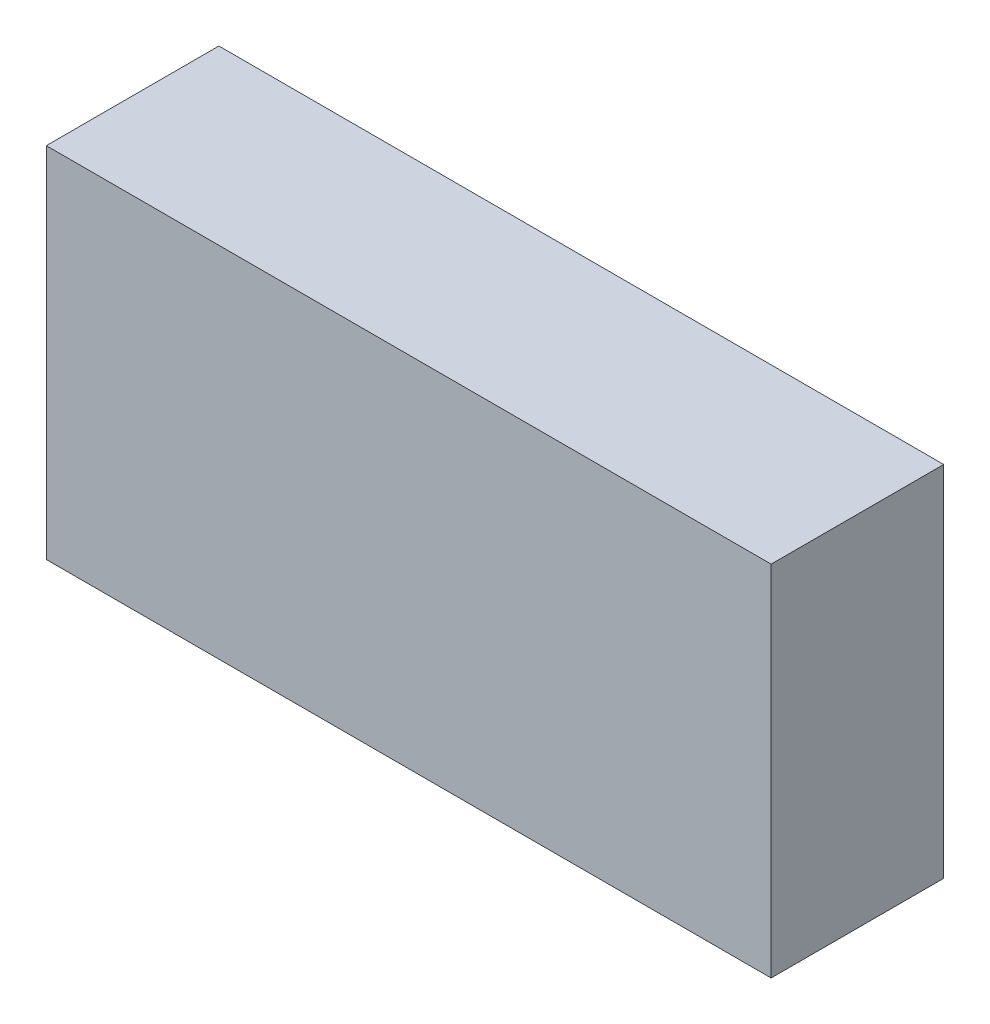
from build123d import *

# Parameters (mm, degrees)
SKETCH_1_W              = 2.73
SKETCH_1_H              = 1.35
COMPONENT_OUTLINE_DEPTH = 0.65


with BuildPart() as part:
    # 草图1 → Component_Outline (new body)
    with BuildSketch(Plane.XY):
        Rectangle(SKETCH_1_W, SKETCH_1_H)
    extrude(amount=COMPONENT_OUTLINE_DEPTH)


solid = part.part
